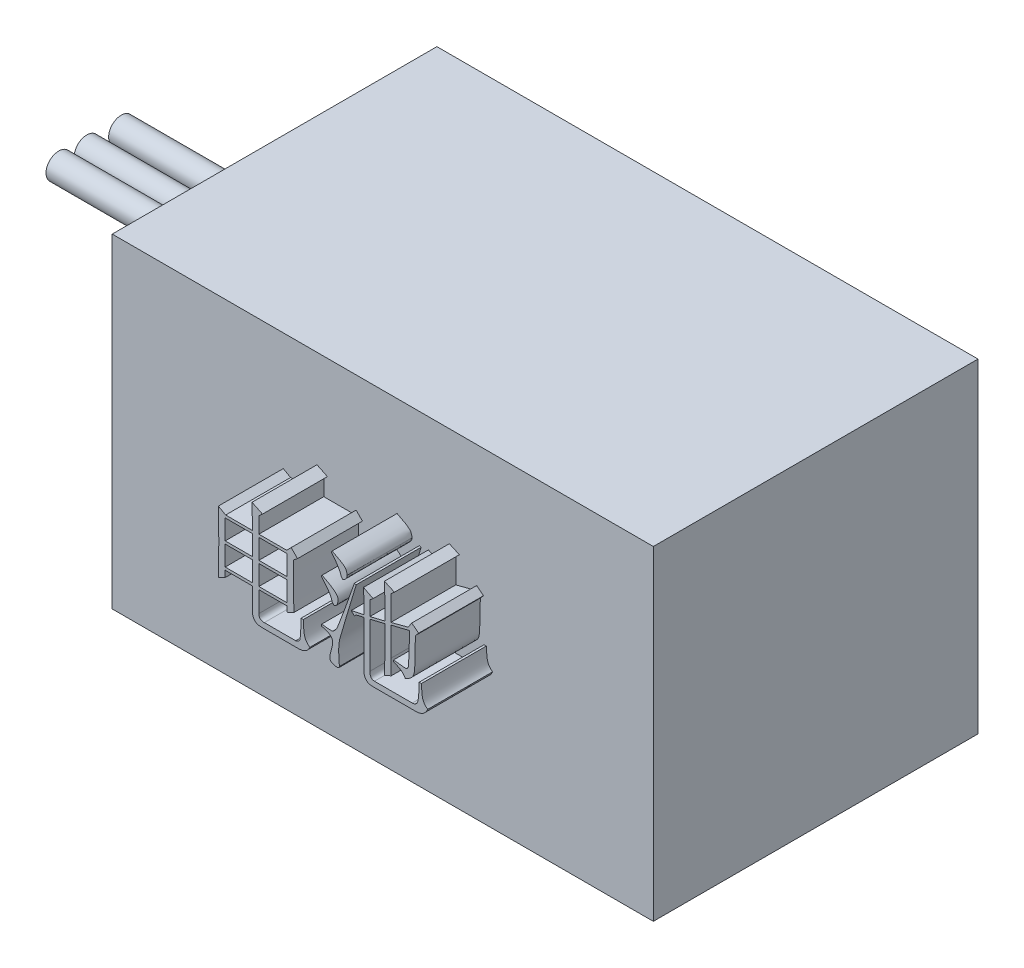
from build123d import *

# Parameters (mm, degrees)
SKETCH_1_W      = 25
SKETCH_1_H      = 15
EXTRUDE_1_DEPTH = 15
SKETCH_2_W      = 1.261471265
SKETCH_2_H      = 0.920406812
SKETCH_2_W_2    = 1.303520307
EXTRUDE_2_DEPTH = 3
SKETCH_3_R      = 0.581181542
SKETCH_3_R_2    = 0.58530212
SKETCH_3_R_3    = 0.590134802
EXTRUDE_3_DEPTH = 5


with BuildPart() as part:
    # 草图1 → 凸台-拉伸1 (new body)
    with BuildSketch(Plane.XY):
        Rectangle(SKETCH_1_W, SKETCH_1_H)
    extrude(amount=EXTRUDE_1_DEPTH)

    # 草图2 → 凸台-拉伸2 (add)
    # profile 1 of 5: a face of its own
    with BuildSketch(Plane.XY.offset(15)):
        with BuildLine():
            add(Edge.make_bspline(
                [(-3.020295554, 1.879358708), (-3.020628633, 1.979291717), (-3.021280109, 2.174752637), (-3.025366041, 2.461316086), (-3.031040256, 2.734674523), (-3.037950188, 2.912423279), (-3.041320075, 2.999109127)],
                knots=[0, 0, 0, 0, 1.070688816, 2.094181113, 3.070555925, 4, 4, 4, 4], degree=3))
            Line((-3.041320075, 2.999109127), (-2.55775609, 2.767060709))
            Line((-2.55775609, 2.767060709), (-2.725952259, 2.619110376))
            Line((-2.725952259, 2.619110376), (-2.725952259, 1.879358708))
            Line((-2.725952259, 1.879358708), (-1.443456473, 1.879358708))
            Line((-1.443456473, 1.879358708), (-1.233211262, 2.089603919))
            Line((-1.233211262, 2.089603919), (-0.938867967, 1.795260624))
            Line((-0.938867967, 1.795260624), (-1.128088657, 1.648867662))
            add(Edge.make_bspline(
                [(-1.128088657, 1.648867662), (-1.128067173, 1.580602904), (-1.128025266, 1.44744769), (-1.128322515, 1.252775035), (-1.127278689, 1.067967938), (-1.126561517, 0.893023069), (-1.125794744, 0.72794144), (-1.124929018, 0.572724116), (-1.124457338, 0.427105031), (-1.12264955, 0.291098551), (-1.1211501, 0.164950996), (-1.119614612, 0.048926095), (-1.117963629, -0.0572328), (-1.116726183, -0.153802614), (-1.114189534, -0.240487798), (-1.111886732, -0.317319097), (-1.109596379, -0.384288881), (-1.107864993, -0.425812177), (-1.107064136, -0.445018901)],
                knots=[0, 0, 0, 0, 1.564731616, 3.052119083, 4.462174954, 5.800836896, 7.0621555, 8.246130873, 9.358712606, 10.399951826, 11.363852354, 12.25041514, 13.059641411, 13.79748155, 14.464070136, 15.047399153, 15.559371661, 16, 16, 16, 16], degree=3))
            Line((-1.107064136, -0.445018901), (-1.422431952, -0.592190548))
            Line((-1.422431952, -0.592190548), (-1.422431952, -0.339896295))
            Line((-1.422431952, -0.339896295), (-2.725952259, -0.339896295))
            Line((-2.725952259, -0.339896295), (-2.725952259, -1.298458719))
            add(Edge.make_bspline(
                [(-2.725952259, -1.298458719), (-2.725277264, -1.316938898), (-2.724006543, -1.351729007), (-2.71274207, -1.400604193), (-2.691535671, -1.441277431), (-2.664178257, -1.476224049), (-2.627123064, -1.502016521), (-2.582728826, -1.520109405), (-2.530736754, -1.530768809), (-2.493436987, -1.532124377), (-2.473658006, -1.532843195)],
                knots=[0, 0, 0, 0, 1.124103962, 2.116197056, 3.020287974, 3.895928428, 4.79003215, 5.731558757, 6.79711165, 8, 8, 8, 8], degree=3))
            Line((-2.473658006, -1.532843195), (-1.022966051, -1.532843195))
            add(Edge.make_bspline(
                [(-1.022966051, -1.532843195), (-1.00804332, -1.530789789), (-0.979174458, -1.526817359), (-0.939457086, -1.512253458), (-0.904018111, -1.493817373), (-0.874768534, -1.468247063), (-0.851134408, -1.437065987), (-0.832063094, -1.400608481), (-0.819164311, -1.358349803), (-0.811816513, -1.309557079), (-0.806875782, -1.252032776), (-0.801077631, -1.182760937), (-0.797127098, -1.100397902), (-0.791236448, -1.005438696), (-0.786042701, -0.89796429), (-0.780254555, -0.777809484), (-0.776150867, -0.644611227), (-0.772554961, -0.551436771), (-0.770671798, -0.502641662)],
                knots=[0, 0, 0, 0, 0.629422311, 1.217652751, 1.762775589, 2.294829829, 2.829987746, 3.394303386, 4.0100451, 4.671629752, 5.458421737, 6.429409418, 7.584151651, 8.913252979, 10.416123777, 12.092816459, 13.95382277, 16, 16, 16, 16], degree=3))
            Line((-0.770671798, -0.502641662), (-0.665549193, -0.502641662))
            add(Edge.make_bspline(
                [(-0.665549193, -0.502641662), (-0.66558901, -0.5446969), (-0.665664977, -0.624934715), (-0.661095596, -0.739649667), (-0.656588601, -0.843085953), (-0.647518441, -0.935198251), (-0.637964215, -1.016353393), (-0.625609516, -1.086566052), (-0.611514734, -1.145900828), (-0.588578073, -1.209222441), (-0.553101294, -1.277392954), (-0.501419943, -1.349675686), (-0.441602924, -1.415437043), (-0.394898343, -1.451483748), (-0.371205898, -1.469769632)],
                knots=[0, 0, 0, 0, 1.432623561, 2.73332378, 3.91109551, 4.959115756, 5.885964426, 6.694330385, 7.387096859, 7.960541899, 8.984902095, 9.993374407, 10.982072752, 12, 12, 12, 12], degree=3))
            add(Edge.make_bspline(
                [(-0.371205898, -1.469769632), (-0.385368514, -1.496105592), (-0.41272128, -1.546969171), (-0.462592707, -1.614489693), (-0.518526993, -1.669959681), (-0.580801057, -1.714367988), (-0.653144151, -1.747278673), (-0.737204872, -1.768676947), (-0.833781098, -1.782985564), (-0.902469392, -1.784392107), (-0.938867967, -1.785137448)],
                knots=[0, 0, 0, 0, 1.033786579, 1.996588944, 2.892065822, 3.749251075, 4.629327101, 5.624996779, 6.741463396, 8, 8, 8, 8], degree=3))
            Line((-0.938867967, -1.785137448), (-2.578780611, -1.785137448))
            add(Edge.make_bspline(
                [(-2.578780611, -1.785137448), (-2.61340091, -1.78383065), (-2.678585336, -1.781370159), (-2.770068418, -1.762246729), (-2.848110028, -1.729101813), (-2.911634316, -1.680849824), (-2.961602618, -1.619656011), (-2.996828457, -1.544657353), (-3.016644445, -1.456241503), (-3.019031524, -1.393302843), (-3.020295554, -1.359974911)],
                knots=[0, 0, 0, 0, 1.182522994, 2.2264996, 3.175847754, 4.055853476, 4.925921917, 5.850408872, 6.861726179, 8, 8, 8, 8], degree=3))
            Line((-3.020295554, -1.359974911), (-3.020295554, -0.339896295))
            Line((-3.020295554, -0.339896295), (-4.281766819, -0.339896295))
            Line((-4.281766819, -0.339896295), (-4.281766819, -0.63423959))
            Line((-4.281766819, -0.63423959), (-4.597134635, -0.781411238))
            add(Edge.make_bspline(
                [(-4.597134635, -0.781411238), (-4.59124721, -0.540031285), (-4.579321658, -0.051092793), (-4.575121278, 0.561039869), (-4.577213705, 1.049548639), (-4.581156136, 1.403078237), (-4.586872386, 1.741059576), (-4.593767808, 1.961127048), (-4.597134635, 2.068579398)],
                knots=[0, 0, 0, 0, 1.524726016, 3.088480342, 3.86542604, 4.609627723, 5.321122896, 6, 6, 6, 6], degree=3))
            Line((-4.597134635, 2.068579398), (-4.260742298, 1.879358708))
            Line((-4.260742298, 1.879358708), (-3.020295554, 1.879358708))
        make_face()
        with Locations((-3.651031187, 1.293008176)):
            Rectangle(SKETCH_2_W, SKETCH_2_H, mode=Mode.SUBTRACT)
        with Locations((-2.074192105, 1.293008176)):
            Rectangle(SKETCH_2_W_2, SKETCH_2_H, mode=Mode.SUBTRACT)
        with Locations((-3.651031187, 0.246454237)):
            Rectangle(SKETCH_2_W, SKETCH_2_H, mode=Mode.SUBTRACT)
        with Locations((-2.074192105, 0.246454237)):
            Rectangle(SKETCH_2_W_2, SKETCH_2_H, mode=Mode.SUBTRACT)
    # profile 2 of 5: a face of its own
    with BuildSketch(Plane.XY.offset(15)):
        with BuildLine():
            Line((3.097840081, 1.210467463), (2.404030885, 1.043828667))
            Line((2.404030885, 1.043828667), (2.404030885, -1.04149235))
            add(Edge.make_bspline(
                [(2.404030885, -1.04149235), (2.404440035, -1.064390162), (2.405207304, -1.10732988), (2.415673204, -1.167184795), (2.43091721, -1.21862854), (2.455089458, -1.260104918), (2.484495925, -1.29388992), (2.521993939, -1.317646236), (2.566432526, -1.330941151), (2.597833037, -1.332620295), (2.614276096, -1.333499588)],
                knots=[0, 0, 0, 0, 1.341381956, 2.515461521, 3.555606715, 4.469749405, 5.310702008, 6.159749455, 7.036342158, 8, 8, 8, 8], degree=3))
            Line((2.614276096, -1.333499588), (4.359311346, -1.333499588))
            add(Edge.make_bspline(
                [(4.359311346, -1.333499588), (4.377542415, -1.332805019), (4.412597251, -1.331469497), (4.462693431, -1.319770609), (4.506568874, -1.299463666), (4.544790211, -1.271337471), (4.575767382, -1.234669416), (4.602161966, -1.191012882), (4.621311488, -1.13891735), (4.633667641, -1.078972101), (4.643373997, -1.012055137), (4.652001206, -0.938044778), (4.658544889, -0.856983304), (4.665441898, -0.768783753), (4.668237197, -0.673163917), (4.673115765, -0.570430151), (4.673937907, -0.460332257), (4.674426506, -0.384539703), (4.674679162, -0.345347097)],
                knots=[0, 0, 0, 0, 0.7605698, 1.462429284, 2.131562217, 2.766653432, 3.427307041, 4.122440357, 4.887321986, 5.731339313, 6.673967508, 7.71042515, 8.841755492, 10.069477544, 11.403612001, 12.835210489, 14.363475806, 16, 16, 16, 16], degree=3))
            Line((4.674679162, -0.345347097), (4.779801768, -0.345347097))
            add(Edge.make_bspline(
                [(4.779801768, -0.345347097), (4.781792578, -0.383767036), (4.785600707, -0.457258783), (4.792401125, -0.562428233), (4.800728952, -0.657228344), (4.810980927, -0.741312465), (4.821533193, -0.814906639), (4.83377366, -0.878125196), (4.847501723, -0.930959905), (4.866960454, -0.987488031), (4.899023557, -1.048356545), (4.947344402, -1.114103751), (5.00509269, -1.175883243), (5.050744509, -1.210587839), (5.074145063, -1.228376982)],
                knots=[0, 0, 0, 0, 1.426525458, 2.728735367, 3.907704043, 4.954667923, 5.869362767, 6.664021964, 7.341038244, 7.89200131, 8.87776317, 9.876918957, 10.911735073, 12, 12, 12, 12], degree=3))
            add(Edge.make_bspline(
                [(5.074145063, -1.228376982), (5.059597018, -1.258125908), (5.031370715, -1.315845152), (4.977517364, -1.393232274), (4.914109645, -1.456735485), (4.844281635, -1.509684014), (4.765188284, -1.547743293), (4.678728188, -1.573429956), (4.584581045, -1.588055113), (4.519249765, -1.586564718), (4.485458472, -1.585793841)],
                knots=[0, 0, 0, 0, 1.075096548, 2.085916022, 3.046068131, 3.980541465, 4.919722121, 5.880207532, 6.903579907, 8, 8, 8, 8], degree=3))
            Line((4.485458472, -1.585793841), (2.530178012, -1.585793841))
            add(Edge.make_bspline(
                [(2.530178012, -1.585793841), (2.498903938, -1.584563441), (2.439769744, -1.582236954), (2.35678422, -1.561861767), (2.285530241, -1.527743857), (2.227786918, -1.477678085), (2.183027559, -1.414080616), (2.152352784, -1.3367644), (2.133641447, -1.246393395), (2.131728906, -1.181757207), (2.130712111, -1.147393642)],
                knots=[0, 0, 0, 0, 1.103584427, 2.086698913, 2.997196219, 3.868565132, 4.756616822, 5.718849767, 6.787235826, 8, 8, 8, 8], degree=3))
            Line((2.130712111, -1.147393642), (2.130712111, 0.979976417))
            Line((2.130712111, 0.979976417), (1.773295253, 0.896657019))
            Line((1.773295253, 0.896657019), (1.689197168, 0.813337621))
            Line((1.689197168, 0.813337621), (1.542025521, 0.958951896))
            Line((1.542025521, 0.958951896), (2.130712111, 1.084320337))
            add(Edge.make_bspline(
                [(2.130712111, 1.084320337), (2.130871796, 1.149211524), (2.131177756, 1.273545307), (2.129097205, 1.451600609), (2.127855259, 1.612793979), (2.125658883, 1.756860097), (2.122178685, 1.88377034), (2.119763588, 1.993873077), (2.114826739, 2.087035934), (2.111281753, 2.143595375), (2.10968759, 2.169029887)],
                knots=[0, 0, 0, 0, 1.435253637, 2.749996107, 3.938441586, 5.000668915, 5.936736011, 6.746544728, 7.436327089, 8, 8, 8, 8], degree=3))
            Line((2.10968759, 2.169029887), (2.551202533, 1.940096213))
            Line((2.551202533, 1.940096213), (2.404030885, 1.814727773))
            Line((2.404030885, 1.814727773), (2.404030885, 1.1473939))
            Line((2.404030885, 1.1473939), (3.097840081, 1.314032697))
            add(Edge.make_bspline(
                [(3.097840081, 1.314032697), (3.097818764, 1.364128101), (3.097777014, 1.462242415), (3.098074814, 1.605781774), (3.097027545, 1.742569516), (3.096311698, 1.872350638), (3.095544119, 1.995383283), (3.094678028, 2.111666068), (3.094208221, 2.221207606), (3.092403823, 2.323729337), (3.090889677, 2.419248481), (3.08934765, 2.508019398), (3.087724586, 2.590038995), (3.086463889, 2.665327805), (3.083904822, 2.73358059), (3.081630836, 2.795098924), (3.079329951, 2.849609731), (3.077614487, 2.883605006), (3.07681556, 2.899437324)],
                knots=[0, 0, 0, 0, 1.516438171, 2.970018801, 4.345049955, 5.657224643, 6.898685937, 8.069434, 9.177326018, 10.214594483, 11.173300777, 12.069158568, 12.902169219, 13.656623382, 14.348458002, 14.969623617, 15.520131973, 16, 16, 16, 16], degree=3))
            Line((3.07681556, 2.899437324), (3.539355024, 2.690749485))
            Line((3.539355024, 2.690749485), (3.371158855, 2.545135209))
            Line((3.371158855, 2.545135209), (3.371158855, 1.398130781))
            Line((3.371158855, 1.398130781), (4.170090656, 1.60681862))
            Line((4.170090656, 1.60681862), (4.338286825, 1.856776815))
            Line((4.338286825, 1.856776815), (4.653654641, 1.60681862))
            Line((4.653654641, 1.60681862), (4.506482994, 1.440179823))
            add(Edge.make_bspline(
                [(4.506482994, 1.440179823), (4.504662482, 1.358677429), (4.501195435, 1.203461359), (4.496305555, 0.982059672), (4.493053131, 0.783727971), (4.48787708, 0.608028535), (4.484019715, 0.455145451), (4.481098827, 0.324834253), (4.478045697, 0.217629933), (4.474898553, 0.130405489), (4.471418911, 0.057100404), (4.464583517, -0.008196204), (4.454211223, -0.068146406), (4.442507932, -0.123146228), (4.4255563, -0.1723085), (4.407410983, -0.216980262), (4.385386939, -0.256434007), (4.351355314, -0.302860016), (4.299378373, -0.355428484), (4.226201986, -0.413583317), (4.140678328, -0.470311196), (4.077256428, -0.503250032), (4.04394353, -0.520551439)],
                knots=[0, 0, 0, 0, 2.278191402, 4.338669061, 6.188688622, 7.821325301, 9.250741611, 10.462437636, 11.463852696, 12.247776932, 12.901606196, 13.514394572, 14.080824745, 14.601670495, 15.083365302, 15.531974723, 15.947650047, 16.342287706, 17.137440704, 18.004054335, 18.951612365, 20, 20, 20, 20], degree=3))
            add(Edge.make_bspline(
                [(4.04394353, -0.520551439), (4.03269119, -0.498322635), (4.009947969, -0.453393794), (3.962493298, -0.392931523), (3.908276128, -0.335654645), (3.843844953, -0.283822144), (3.77050103, -0.236398056), (3.687620723, -0.193941569), (3.596066801, -0.15536937), (3.530980047, -0.134827876), (3.497305982, -0.124200282)],
                knots=[0, 0, 0, 0, 0.857490565, 1.73315924, 2.638712329, 3.57422351, 4.577545369, 5.646778278, 6.782508935, 8, 8, 8, 8], degree=3))
            Line((3.497305982, -0.124200282), (3.497305982, -0.040880884))
            add(Edge.make_bspline(
                [(3.497305982, -0.040880884), (3.532324284, -0.045983908), (3.598915887, -0.055687936), (3.694052485, -0.066854949), (3.778857572, -0.077341686), (3.853621373, -0.085154662), (3.918258483, -0.090713471), (3.972523235, -0.094029152), (4.016703356, -0.094885634), (4.060733146, -0.093923145), (4.107305598, -0.082156031), (4.151070468, -0.046375169), (4.178735191, 0.008223088), (4.190199885, 0.05820476), (4.193563577, 0.100593283), (4.197253606, 0.133213037), (4.1987527, 0.174582695), (4.202605426, 0.224605529), (4.204410177, 0.283312768), (4.206648986, 0.350808415), (4.210217104, 0.426826773), (4.212232137, 0.511984554), (4.214318444, 0.605699137), (4.218064486, 0.708196236), (4.219660633, 0.819320072), (4.223443628, 0.939210293), (4.225416638, 1.067708152), (4.22755121, 1.204765016), (4.231184845, 1.350619693), (4.232490919, 1.45081994), (4.233164219, 1.502474701)],
                knots=[0, 0, 0, 0, 1.336413042, 2.541353534, 3.617425364, 4.563580778, 5.38009713, 6.067408733, 6.616450012, 7.048216175, 7.73089842, 8.386144333, 9.114521985, 10.001386096, 10.306690878, 10.720269174, 11.240646342, 11.869246219, 12.614835096, 13.458384009, 14.419852984, 15.488756895, 16.675253639, 17.960011834, 19.362112921, 20.872244914, 22.489965289, 24.215499161, 26.049031938, 28, 28, 28, 28], degree=3))
            Line((4.233164219, 1.502474701), (3.371158855, 1.293786862))
            Line((3.371158855, 1.293786862), (3.371158855, -0.040880884))
            add(Edge.make_bspline(
                [(3.371158855, -0.040880884), (3.371518706, -0.094353077), (3.372254213, -0.203646085), (3.376452949, -0.371590057), (3.382325742, -0.547354252), (3.388849705, -0.667213748), (3.392183376, -0.728460592)],
                knots=[0, 0, 0, 0, 0.9326831, 1.906331799, 2.930159278, 4, 4, 4, 4], degree=3))
            Line((3.392183376, -0.728460592), (3.07681556, -0.874853554))
            add(Edge.make_bspline(
                [(3.07681556, -0.874853554), (3.082849288, -0.723548545), (3.094768834, -0.424647574), (3.096824836, -0.125516773), (3.097840081, 0.022192679)],
                knots=[0, 0, 0, 0, 1.012408946, 2, 2, 2, 2], degree=3))
            Line((3.097840081, 0.022192679), (3.097840081, 1.210467463))
        make_face()
    # profile 3 of 5: a face of its own
    with BuildSketch(Plane.XY.offset(15)):
        with BuildLine():
            add(Edge.make_bspline(
                [(1.773295253, 2.10673501), (1.746051257, 2.016404419), (1.693128265, 1.840932174), (1.615854367, 1.585319082), (1.543753098, 1.345128807), (1.47572499, 1.120433326), (1.412625205, 0.910974521), (1.354533677, 0.716729021), (1.300476515, 0.537989326), (1.251631454, 0.374661192), (1.206990501, 0.226527656), (1.167729407, 0.093756947), (1.132028109, -0.023293141), (1.102864246, -0.125579257), (1.07725133, -0.21222166), (1.055926329, -0.283513043), (1.039783169, -0.339379536), (1.016883467, -0.416943032), (0.992689474, -0.527278116), (0.972035539, -0.680649556), (0.961332834, -0.848465354), (0.961961937, -0.995604162), (0.966495092, -1.114431737), (0.96960138, -1.198271579), (0.972508994, -1.274862942), (0.976163907, -1.344195577), (0.981468441, -1.406151592), (0.984760827, -1.461003612), (0.989332293, -1.508807225), (0.993476579, -1.538046265), (0.995387973, -1.551531658)],
                knots=[0, 0, 0, 0, 2.099872221, 4.079119681, 5.943273429, 7.681271436, 9.304175454, 10.811986956, 12.193641282, 13.460202943, 14.606139685, 15.636986096, 16.541672997, 17.329641089, 18.004152826, 18.552500733, 18.98576718, 19.298413614, 20.35234309, 21.495305488, 22.739966369, 24.091757684, 24.768048226, 25.38660679, 25.958985128, 26.4739387, 26.931627051, 27.342801753, 27.696892348, 28, 28, 28, 28], degree=3))
            add(Edge.make_bspline(
                [(0.995387973, -1.551531658), (0.994593616, -1.564134396), (0.993086114, -1.588051439), (0.969828174, -1.617667086), (0.933362426, -1.63344342), (0.905751401, -1.634844133), (0.890265367, -1.635629743)],
                knots=[0, 0, 0, 0, 0.970945968, 1.84262797, 2.790007448, 4, 4, 4, 4], degree=3))
            add(Edge.make_bspline(
                [(0.890265367, -1.635629743), (0.875427469, -1.635250192), (0.843708552, -1.634438829), (0.794008202, -1.624407838), (0.738302572, -1.612515451), (0.680434207, -1.594917053), (0.623634987, -1.570817386), (0.582806644, -1.526115715), (0.557046416, -1.469399593), (0.554977318, -1.426992759), (0.55387303, -1.404360011)],
                knots=[0, 0, 0, 0, 0.773098138, 1.652648856, 2.638415398, 3.7437562, 4.81590307, 5.802785575, 6.827335235, 8, 8, 8, 8], degree=3))
            add(Edge.make_bspline(
                [(0.55387303, -1.404360011), (0.554802497, -1.384597542), (0.556881554, -1.340392356), (0.569493592, -1.268001064), (0.590483535, -1.182812398), (0.607663377, -1.121904233), (0.616946593, -1.088992194)],
                knots=[0, 0, 0, 0, 0.735604743, 1.64541913, 2.727690164, 4, 4, 4, 4], degree=3))
            add(Edge.make_bspline(
                [(0.616946593, -1.088992194), (0.626315884, -1.055842235), (0.644009757, -0.993238656), (0.664626992, -0.904013221), (0.67725626, -0.82485918), (0.679145076, -0.775477973), (0.680020156, -0.752599857)],
                knots=[0, 0, 0, 0, 1.204024663, 2.273796248, 3.200256724, 4, 4, 4, 4], degree=3))
            add(Edge.make_bspline(
                [(0.680020156, -0.752599857), (0.678740817, -0.729417488), (0.676273608, -0.684710238), (0.659686802, -0.620765934), (0.62792378, -0.566087618), (0.592866608, -0.526191581), (0.556653299, -0.498901016), (0.522668448, -0.477537022), (0.481452081, -0.457145301), (0.433706027, -0.435957336), (0.379065085, -0.41510228), (0.317480473, -0.394171831), (0.248917946, -0.373156382), (0.200648255, -0.360004593), (0.17543165, -0.353133957)],
                knots=[0, 0, 0, 0, 1.187079274, 2.289285076, 3.342195022, 4.395775184, 4.983000191, 5.657502931, 6.447674094, 7.333854754, 8.330539672, 9.439608888, 10.662424192, 12, 12, 12, 12], degree=3))
            Line((0.17543165, -0.353133957), (0.17543165, -0.269035872))
            add(Edge.make_bspline(
                [(0.17543165, -0.269035872), (0.205546855, -0.272090383), (0.262668383, -0.277884079), (0.343802227, -0.287047088), (0.41627545, -0.29303424), (0.479867242, -0.297805373), (0.534635683, -0.300989958), (0.580342474, -0.302741977), (0.617203428, -0.302675411), (0.656001829, -0.301759205), (0.702460714, -0.286453837), (0.753703749, -0.245888561), (0.807359034, -0.186897047), (0.847980578, -0.129805689), (0.878473002, -0.078109155), (0.898586126, -0.032940562), (0.925349725, 0.025978269), (0.956397941, 0.099927477), (0.990824073, 0.18889046), (1.031913555, 0.291862453), (1.076736167, 0.409745015), (1.12560657, 0.542644684), (1.180293318, 0.689654226), (1.23960351, 0.851483839), (1.30222563, 1.028594758), (1.371094158, 1.219936061), (1.443910726, 1.426163337), (1.522408159, 1.646740012), (1.603378976, 1.882620551), (1.660039341, 2.044470432), (1.689197168, 2.127759531)],
                knots=[0, 0, 0, 0, 0.806078407, 1.528942978, 2.174139014, 2.742443627, 3.227077505, 3.635123599, 3.959990669, 4.209208728, 4.666085266, 5.230170781, 5.929520146, 6.78686705, 7.090368904, 7.526322458, 8.101811569, 8.814290953, 9.661434987, 10.642071693, 11.766594832, 13.019739121, 14.412841836, 15.943517101, 17.609453901, 19.415342579, 21.358862449, 23.43350708, 25.650050269, 28, 28, 28, 28], degree=3))
            Line((1.689197168, 2.127759531), (1.773295253, 2.10673501))
        make_face()
    # profile 4 of 5: a face of its own
    with BuildSketch(Plane.XY.offset(15)):
        with BuildLine():
            add(Edge.make_bspline(
                [(0.196456171, 1.701039622), (0.254067942, 1.672184048), (0.362810421, 1.617719022), (0.512556441, 1.533673397), (0.639941327, 1.454113452), (0.744377173, 1.378258472), (0.825967214, 1.305943655), (0.885043897, 1.237764313), (0.923128885, 1.172370132), (0.934579055, 1.108808997), (0.931124569, 1.052275571), (0.926503045, 1.00088755), (0.91671068, 0.954354374), (0.904731463, 0.912114593), (0.888371627, 0.874310302), (0.867969114, 0.84142052), (0.844407288, 0.8127913), (0.818115595, 0.789870071), (0.790270189, 0.77406925), (0.760717452, 0.768871117), (0.731854842, 0.779105109), (0.706259468, 0.80169582), (0.682059944, 0.834896725), (0.658933308, 0.879353318), (0.63674416, 0.935575729), (0.623894833, 0.977533629), (0.616946593, 1.000222252)],
                knots=[0, 0, 0, 0, 2.782636489, 5.252239056, 7.413831846, 9.265898059, 10.821636069, 12.110617316, 13.153870737, 14.044324011, 14.851802302, 15.595855226, 16.270825857, 16.902215511, 17.489572371, 18.04333773, 18.568685677, 19.085471199, 19.541814969, 19.938171372, 20.338785554, 20.81678546, 21.393017335, 22.105224683, 22.975405283, 24, 24, 24, 24], degree=3))
            add(Edge.make_bspline(
                [(0.616946593, 1.000222252), (0.607132506, 1.022692009), (0.586576873, 1.069754977), (0.548036152, 1.14039087), (0.501474828, 1.214619892), (0.44801834, 1.293045201), (0.386131593, 1.375118425), (0.315775218, 1.460191355), (0.238806526, 1.550360575), (0.183191252, 1.610140982), (0.154407129, 1.641080803)],
                knots=[0, 0, 0, 0, 0.740632677, 1.551257265, 2.42836451, 3.38773932, 4.41833746, 5.533066129, 6.723218966, 8, 8, 8, 8], degree=3))
            Line((0.154407129, 1.641080803), (0.196456171, 1.701039622))
        make_face()
    # profile 5 of 5: a face of its own
    with BuildSketch(Plane.XY.offset(15)):
        with BuildLine():
            add(Edge.make_bspline(
                [(0.658995635, 2.899437324), (0.705343742, 2.876883895), (0.793143965, 2.834159473), (0.914885219, 2.769460648), (1.020783773, 2.710537272), (1.109735721, 2.655700579), (1.181811932, 2.604685505), (1.236911712, 2.55795743), (1.277029058, 2.516534913), (1.305387457, 2.46711683), (1.322068882, 2.412562409), (1.339075782, 2.357173995), (1.350335534, 2.311712634), (1.35206492, 2.284316469), (1.352804831, 2.272595121)],
                knots=[0, 0, 0, 0, 1.878989626, 3.559491816, 5.025500953, 6.296379828, 7.367815302, 8.24024707, 8.930256996, 9.456105514, 10.300157888, 11.000792397, 11.572492724, 12, 12, 12, 12], degree=3))
            add(Edge.make_bspline(
                [(1.352804831, 2.272595121), (1.351946728, 2.256128032), (1.350239245, 2.223361225), (1.335140083, 2.176007592), (1.312536947, 2.130408989), (1.28029806, 2.090937861), (1.24715226, 2.05674517), (1.216752759, 2.031012732), (1.189500855, 2.013913351), (1.171523514, 2.010782118), (1.163584141, 2.009399264)],
                knots=[0, 0, 0, 0, 1.143265861, 2.274911553, 3.430245753, 4.666104687, 5.803073093, 6.739861216, 7.443482172, 8, 8, 8, 8], degree=3))
            add(Edge.make_bspline(
                [(1.163584141, 2.009399264), (1.158269528, 2.010070771), (1.146877423, 2.011510175), (1.130602606, 2.022416645), (1.114809161, 2.038716085), (1.098904665, 2.061384921), (1.083915413, 2.090147427), (1.068230831, 2.12504822), (1.051789072, 2.165905732), (1.042406467, 2.195946607), (1.037437015, 2.211857616)],
                knots=[0, 0, 0, 0, 0.510822831, 1.094971087, 1.83877409, 2.700560191, 3.753946213, 4.964433001, 6.39222622, 8, 8, 8, 8], degree=3))
            add(Edge.make_bspline(
                [(1.037437015, 2.211857616), (1.02779036, 2.234277347), (1.007681949, 2.281011185), (0.97200499, 2.351739413), (0.928339924, 2.424923397), (0.879870454, 2.502134972), (0.822940882, 2.58138671), (0.760978509, 2.664936188), (0.691516411, 2.751114637), (0.642261534, 2.808966425), (0.616946593, 2.838699818)],
                knots=[0, 0, 0, 0, 0.77271414, 1.610719408, 2.505781945, 3.470187486, 4.496283323, 5.594276577, 6.763559043, 8, 8, 8, 8], degree=3))
            Line((0.616946593, 2.838699818), (0.658995635, 2.899437324))
        make_face()
    extrude(amount=EXTRUDE_2_DEPTH)

    # 草图3 → 凸台-拉伸3 (add)
    with BuildSketch(Plane.ZY.offset(12.5)):
        with Locations(Location((9.58530212, 6.469678794, 0), (0, 0, 180))):
            Circle(SKETCH_3_R)
        with Locations(Location((11.173979304, 6.469678794, 0), (0, 0, 180))):
            Circle(SKETCH_3_R_2)
        with Locations(Location((12.470005427, 6.469678794, 0), (0, 0, 180))):
            Circle(SKETCH_3_R_3)
    extrude(amount=EXTRUDE_3_DEPTH)


solid = part.part
